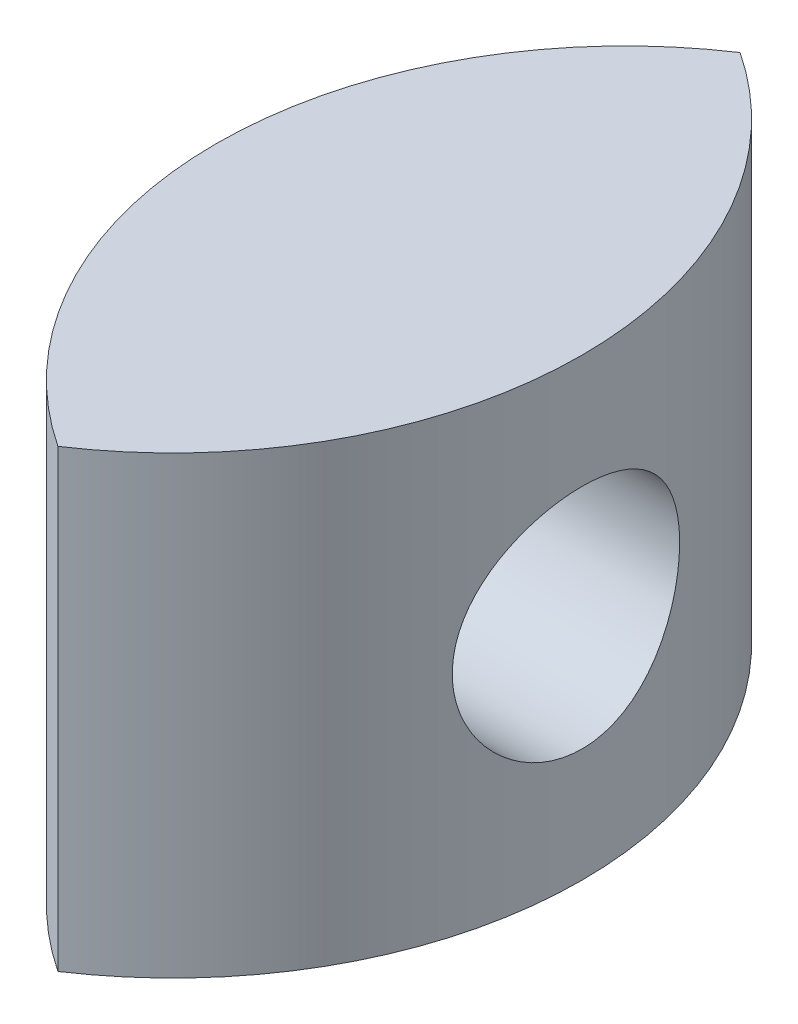
from build123d import *

# Parameters (mm, degrees)
BOSS_EXTRUDE1_DEPTH     = 100
CUT_EXTRUDE1_DEPTH      = 132.320649808
CUT_EXTRUDE1_DEPTH_BACK = 132.320649808
SKETCH2_R               = 25


with BuildPart() as part:
    # Sketch1 → Boss-Extrude1 (new body)
    with BuildSketch(Plane(origin=(0, 0, 0), x_dir=(1, 0, 0), z_dir=(0, 1, 0))):
        with BuildLine():
            ThreePointArc((0, 75), (-40.250628145, 0), (0, -75))
            ThreePointArc((0, -75), (40.250628145, 0), (0, 75))
        make_face()
    extrude(amount=BOSS_EXTRUDE1_DEPTH)

    # Sketch2 → Cut-Extrude1 (cut, two sides: drawn at the far end of the back side and taken through both)
    with BuildSketch(Plane(origin=(0, 0, 0), x_dir=(0, 0, -1), z_dir=(1, 0, 0)).offset(-CUT_EXTRUDE1_DEPTH_BACK)):
        with Locations((0, 50)):
            Circle(SKETCH2_R)
    extrude(amount=CUT_EXTRUDE1_DEPTH + CUT_EXTRUDE1_DEPTH_BACK, mode=Mode.SUBTRACT)


solid = part.part
